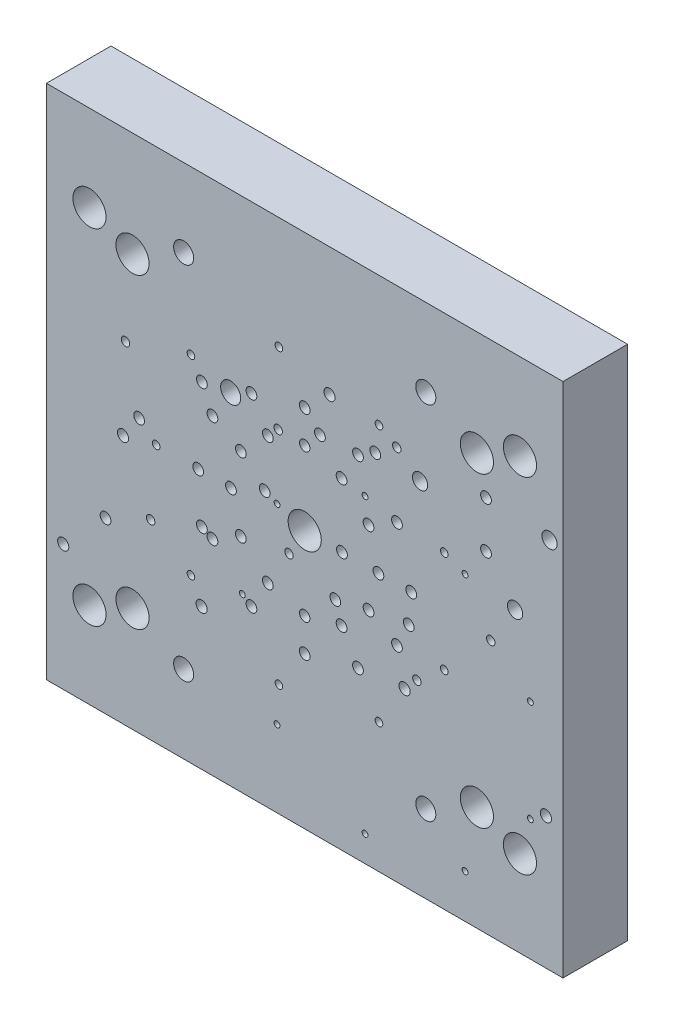
from build123d import *

# Parameters (mm, degrees)
SKETCH1_W                               = 304.8
SKETCH1_H                               = 304.8
BOSS_EXTRUDE1_DEPTH                     = 38.1
SKETCH2_R                               = 6.5151
HAAS_T_SLOT_HOLES_DEPTH                 = 219.867836833
SKETCH3_R                               = 9.779
HAAS_COUNTER_BORES_DEPTH                = 22.225
SKETCH4_R                               = 6.5151
TORMACH_T_SLOT_HOLES_DEPTH              = 219.867836833
SKETCH5_R                               = 9.779
TORMACH_COUNTER_BORES_DEPTH             = 22.225
SKETCH6_R                               = 3.0734
SPROCKET_LOCATING_HOLES_DEPTH           = 6.35
SKETCH7_R                               = 3.175
SPROCKET_MOUNTING_CLEARANCE_HOLES_DEPTH = 9.525
SKETCH8_R                               = 5.9182
F_1_2_13_TAPPED_HOLES_DEPTH             = 19.05
SKETCH9_R                               = 3.175
SKETCH9_R_2                             = 4.5
SKETCH9_R_3                             = 3.3
SKETCH9_R_4                             = 2.5
SSB_HOLES_DEPTH                         = 19.05
SKETCH10_R                              = 3.175
SPROCKET_COUNTERSUNK_HOLES_DEPTH        = 19.05
SKETCH12_R                              = 3.3
SKETCH12_R_2                            = 2.49642527
SKETCH12_R_3                            = 2.5
SKETCH12_R_4                            = 5.9182
DSB_HOLES_DEPTH                         = 19.05
ROTOR_CLAMP_BOLTS_D                     = 4.5
ROTOR_CLAMP_BOLTS_DEPTH                 = 19.05
ROTOR_CLAMP_BOLTS_TIP                   = 1.351936393
NEW_ROTOR_HOLES_R                       = 1.7272
F_8_32_HOLE_PREP_DEPTH                  = 19.05


with BuildPart() as part:
    # Sketch1 → Boss-Extrude1 (new body)
    with BuildSketch(Plane.XY):
        Rectangle(SKETCH1_W, SKETCH1_H)
    extrude(amount=BOSS_EXTRUDE1_DEPTH)

    # Sketch2 → HAAS T-Slot Holes (cut, through all)
    with BuildSketch(Plane.XY.offset(38.1)):
        with Locations((-127, 101.6)):
            Circle(SKETCH2_R)
        with Locations((127, 101.6)):
            Circle(SKETCH2_R)
        with Locations((127, -101.6)):
            Circle(SKETCH2_R)
        with Locations((-127, -101.6)):
            Circle(SKETCH2_R)
        Circle(SKETCH2_R)
    extrude(amount=-HAAS_T_SLOT_HOLES_DEPTH, mode=Mode.SUBTRACT)

    # Sketch3 → HAAS Counter Bores (cut)
    with BuildSketch(Plane.XY.offset(38.1)):
        with Locations((-127, 101.6)):
            Circle(SKETCH3_R)
        with Locations((127, 101.6)):
            Circle(SKETCH3_R)
        Circle(SKETCH3_R)
        with Locations((127, -101.6)):
            Circle(SKETCH3_R)
        with Locations((-127, -101.6)):
            Circle(SKETCH3_R)
    extrude(amount=-HAAS_COUNTER_BORES_DEPTH, mode=Mode.SUBTRACT)

    # Sketch4 → Tormach T-Slot Holes (cut, through all)
    with BuildSketch(Plane.XY.offset(38.1)):
        with Locations((-101.6, 90.4875)):
            Circle(SKETCH4_R)
        with Locations((101.6, 90.4875)):
            Circle(SKETCH4_R)
        with Locations((-101.6, -90.4875)):
            Circle(SKETCH4_R)
        with Locations((101.6, -90.4875)):
            Circle(SKETCH4_R)
    extrude(amount=-TORMACH_T_SLOT_HOLES_DEPTH, mode=Mode.SUBTRACT)

    # Sketch5 → Tormach Counter bores (cut)
    with BuildSketch(Plane.XY.offset(38.1)):
        with Locations((-101.6, 90.4875)):
            Circle(SKETCH5_R)
        with Locations((101.6, 90.4875)):
            Circle(SKETCH5_R)
        with Locations((101.6, -90.4875)):
            Circle(SKETCH5_R)
        with Locations((-101.6, -90.4875)):
            Circle(SKETCH5_R)
    extrude(amount=-TORMACH_COUNTER_BORES_DEPTH, mode=Mode.SUBTRACT)

    # Sketch6 → Sprocket Locating Holes (cut)
    with BuildSketch(Plane.XY.offset(38.1)):
        with Locations((0, 43.50004)):
            Circle(SKETCH6_R)
        with Locations((0, -43.50004)):
            Circle(SKETCH6_R)
    extrude(amount=-SPROCKET_LOCATING_HOLES_DEPTH, mode=Mode.SUBTRACT)

    # Sketch7 → Sprocket Mounting clearance holes (cut)
    with BuildSketch(Plane.XY.offset(38.1)):
        with Locations((43.50004, 0)):
            Circle(SKETCH7_R)
        with Locations((37.672139706, -21.75002)):
            Circle(SKETCH7_R)
        with Locations((21.75002, -37.672139706)):
            Circle(SKETCH7_R)
        with Locations((-21.75002, -37.672139706)):
            Circle(SKETCH7_R)
        with Locations((-37.672139706, -21.75002)):
            Circle(SKETCH7_R)
        with Locations((-43.50004, 0)):
            Circle(SKETCH7_R)
        with Locations((-37.672139706, 21.75002)):
            Circle(SKETCH7_R)
        with Locations((-21.75002, 37.672139706)):
            Circle(SKETCH7_R)
        with Locations((21.75002, 37.672139706)):
            Circle(SKETCH7_R)
        with Locations((37.672139706, 21.75002)):
            Circle(SKETCH7_R)
    extrude(amount=-SPROCKET_MOUNTING_CLEARANCE_HOLES_DEPTH, mode=Mode.SUBTRACT)

    # Sketch8 → 1/2-13 Tapped Holes (cut)
    with BuildSketch(Plane.XY.offset(38.1)):
        with Locations((-71.4375, 106.4641)):
            Circle(SKETCH8_R)
        with Locations((71.4375, 106.4641)):
            Circle(SKETCH8_R)
        with Locations((71.4375, -106.4641)):
            Circle(SKETCH8_R)
        with Locations((-71.4375, -106.4641)):
            Circle(SKETCH8_R)
    extrude(amount=-F_1_2_13_TAPPED_HOLES_DEPTH, mode=Mode.SUBTRACT)

    # Sketch9 → SSB Holes (cut)
    with BuildSketch(Plane.XY.offset(38.1)):
        with Locations((-117.518879062, -52.287624978)):
            Circle(SKETCH9_R)
        with Locations((-60.663402782, -28.410064907)):
            Circle(SKETCH9_R)
        with Locations((-60.663402782, 45.677048092)):
            Circle(SKETCH9_R)
        with Locations((-23.619846283, 8.633491593)):
            Circle(SKETCH9_R)
        with Locations((-97.706959282, 8.633491593)):
            Circle(SKETCH9_R)
        with Locations((18.062330035, -26.179653161)):
            Circle(SKETCH9_R)
        with Locations((21.976192961, 0)):
            Circle(SKETCH9_R)
        with Locations((61.383342435, -17.37389998)):
            Circle(SKETCH9_R)
        with Locations((106.975954286, 70.395873002)):
            Circle(SKETCH9_R)
        with Locations((106.975954286, 42.900373002)):
            Circle(SKETCH9_R)
        with Locations((144.453874291, 67.437261617)):
            Circle(SKETCH9_R_2)
        with Locations((124.109154154, 21.613091073)):
            Circle(SKETCH9_R_2)
        with Locations((68.068126679, 59.327852632)):
            Circle(SKETCH9_R_2)
        with Locations((58.935264171, -51.265183733)):
            Circle(SKETCH9_R_3)
        with Locations((-142.492281823, -78.095030045)):
            Circle(SKETCH9_R_3)
        with Locations((-105.735065575, 43.771330358)):
            Circle(SKETCH9_R_4)
        with Locations((-90.897481142, -39.864168204)):
            Circle(SKETCH9_R_4)
        with Locations((-9.271096491, -16.365575471)):
            Circle(SKETCH9_R_4)
        with Locations((-15.665485897, 43.865720815)):
            Circle(SKETCH9_R_4)
        with Locations((14.626715825, 76.840475586)):
            Circle(SKETCH9_R_3)
        with Locations((8.985545702, 53.468225166)):
            Circle(SKETCH9_R)
        with Locations((41.65587457, 60.657920909)):
            Circle(SKETCH9_R)
    extrude(amount=-SSB_HOLES_DEPTH, mode=Mode.SUBTRACT)

    # Sketch10 → Sprocket Countersunk Holes (cut)
    with BuildSketch(Plane.XY.offset(38.1)):
        with Locations((0, 62.865)):
            Circle(SKETCH10_R)
        with Locations((31.4325, 54.442687009)):
            Circle(SKETCH10_R)
        with Locations((54.442687009, 31.4325)):
            Circle(SKETCH10_R)
        with Locations((62.865, 0)):
            Circle(SKETCH10_R)
        with Locations((54.442687009, -31.4325)):
            Circle(SKETCH10_R)
        with Locations((31.4325, -54.442687009)):
            Circle(SKETCH10_R)
        with Locations((0, -62.865)):
            Circle(SKETCH10_R)
        with Locations((-31.4325, -54.442687009)):
            Circle(SKETCH10_R)
        with Locations((-54.442687009, -31.4325)):
            Circle(SKETCH10_R)
        with Locations((-62.865, 0)):
            Circle(SKETCH10_R)
        with Locations((-54.442687009, 31.4325)):
            Circle(SKETCH10_R)
        with Locations((-31.4325, 54.442687009)):
            Circle(SKETCH10_R)
    extrude(amount=-SPROCKET_COUNTERSUNK_HOLES_DEPTH, mode=Mode.SUBTRACT)

    # Sketch12 → DSB Holes (cut)
    with BuildSketch(Plane.XY.offset(38.1)):
        with Locations((-107.214384135, -4.997743719)):
            Circle(SKETCH12_R)
        with Locations((-60.82118122, -69.139225755)):
            Circle(SKETCH12_R)
        with Locations((142.312853496, -74.567013373)):
            Circle(SKETCH12_R)
        with Locations((54.330714956, 69.71862905)):
            Circle(SKETCH12_R_2)
        with Locations((109.782250799, -1.260675802)):
            Circle(SKETCH12_R_3)
        with Locations((66.20937145, -43.333249451)):
            Circle(SKETCH12_R_3)
        with Locations((-43.688566445, 48.748942815)):
            Circle(SKETCH12_R_4)
    extrude(amount=-DSB_HOLES_DEPTH, mode=Mode.SUBTRACT)

    # Rotor Clamp Bolts
    with Locations(Plane.XY.offset(38.1)):
        with Locations((-87.63, 0), (-67.128474551, -56.327478237), (-15.216789809, -86.298703396), (43.815, -75.889806134), (82.345264359, -29.97122516), (82.345264359, 29.97122516), (43.815, 75.889806134), (-15.216789809, 86.298703396), (-67.128474551, 56.327478237)):
            Hole(ROTOR_CLAMP_BOLTS_D / 2, depth=ROTOR_CLAMP_BOLTS_DEPTH)
            with Locations((0, 0, -(ROTOR_CLAMP_BOLTS_DEPTH + ROTOR_CLAMP_BOLTS_TIP / 2))):  # 118° drill point
                Cone(0, ROTOR_CLAMP_BOLTS_D / 2, ROTOR_CLAMP_BOLTS_TIP, mode=Mode.SUBTRACT)

    # New Rotor Holes → 8-32 hole Prep (cut)
    with BuildSketch(Plane.XY.offset(38.1)):
        with Locations((-36.83, -50.8)):
            Circle(NEW_ROTOR_HOLES_R)
        with Locations((-16.328474551, -107.127478237)):
            Circle(NEW_ROTOR_HOLES_R)
        with Locations((35.583210191, -137.098703396)):
            Circle(NEW_ROTOR_HOLES_R)
        with Locations((94.615, -126.689806134)):
            Circle(NEW_ROTOR_HOLES_R)
        with Locations((133.145264359, -80.77122516)):
            Circle(NEW_ROTOR_HOLES_R)
        with Locations((133.145264359, -20.82877484)):
            Circle(NEW_ROTOR_HOLES_R)
        with Locations((94.615, 25.089806134)):
            Circle(NEW_ROTOR_HOLES_R)
        with Locations((35.583210191, 35.498703396)):
            Circle(NEW_ROTOR_HOLES_R)
        with Locations((-16.328474551, 5.527478237)):
            Circle(NEW_ROTOR_HOLES_R)
    extrude(amount=-F_8_32_HOLE_PREP_DEPTH, mode=Mode.SUBTRACT)


solid = part.part
